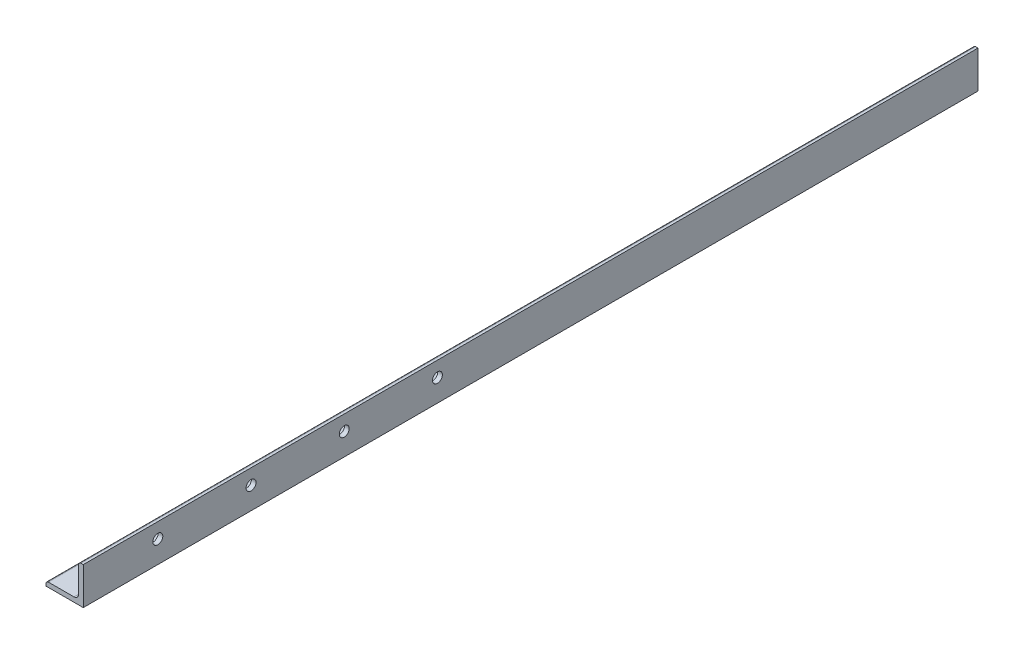
from build123d import *

# Parameters (mm, degrees)
BOSS_EXTRUDE1_DEPTH      = 304.8
F_1_4_CLEARANCE_HOLE1_D  = 6.7564
F_1_4_CLEARANCE_HOLE2_D  = 6.7564
F_5_16_CLEARANCE_HOLE1_D = 8.4328


with BuildPart() as part:
    # Sketch2 → Boss-Extrude1 (new, symmetric)
    with BuildSketch(Plane.XY):
        with BuildLine():
            Line((-12.7, -12.7), (12.7, -12.7))
            Line((12.7, -12.7), (12.7, 12.7))
            Line((12.7, 12.7), (11.1125, 12.7))
            ThreePointArc((11.1125, 12.7), (9.989967985, 12.235032015), (9.525, 11.1125))
            Line((9.525, 11.1125), (9.525, -6.35))
            ThreePointArc((9.525, -6.35), (8.59506403, -8.59506403), (6.35, -9.525))
            Line((6.35, -9.525), (-11.1125, -9.525))
            ThreePointArc((-11.1125, -9.525), (-12.235032015, -9.989967985), (-12.7, -11.1125))
            Line((-12.7, -11.1125), (-12.7, -12.7))
        make_face()
    extrude(amount=BOSS_EXTRUDE1_DEPTH, both=True)

    # 1/4 Clearance Hole1 (through all)
    with Locations(Plane(origin=(0, -9.525, 0), x_dir=(-1, 0, 0), z_dir=(0, 1, 0))):
        with Locations((2.38125, 282.575), (2.38125, -228.6), (2.38125, 105.9688)):
            Hole(F_1_4_CLEARANCE_HOLE1_D / 2)

    # 1/4 Clearance Hole2 (through all)
    with Locations(Plane.ZY.offset(-9.525)):
        with Locations((254, 2.38125), (190.5, 2.38125), (127, 2.38125), (63.5, 2.38125)):
            Hole(F_1_4_CLEARANCE_HOLE2_D / 2)

    # 5/16 Clearance Hole1 (through all)
    with Locations(Plane(origin=(0, -9.525, 0), x_dir=(1, 0, 0), z_dir=(0, 1, 0))):
        with Locations((-2.38125, 279.4)):
            Hole(F_5_16_CLEARANCE_HOLE1_D / 2)


solid = part.part
